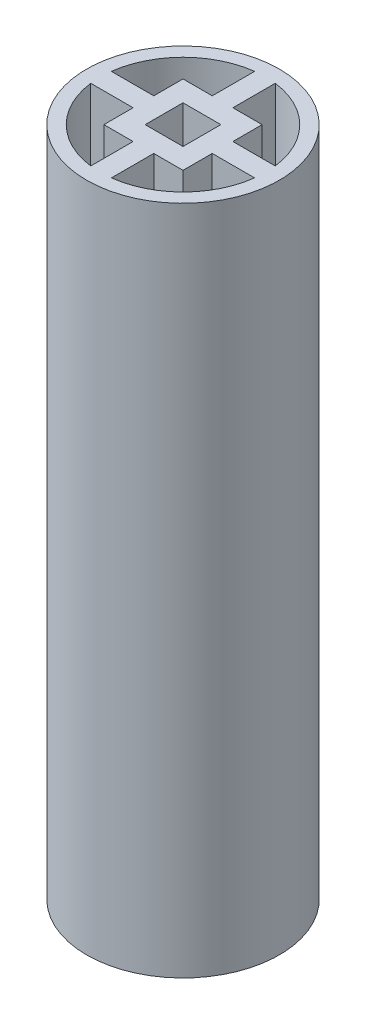
from build123d import *

# Parameters (mm, degrees)
SKETCH1_R  = 14
SKETCH1_W  = 5.5
SKETCH1_H  = 5.5
BODY_DEPTH = 48.75


with BuildPart() as part:
    # Sketch1 → Body (new, symmetric)
    with BuildSketch(Plane(origin=(0, 0, 0), x_dir=(1, 0, 0), z_dir=(0, 1, 0))):
        with Locations(Location((0, 0, 0), (0, 0, 270))):
            Circle(SKETCH1_R)
        with BuildLine():
            Line((-5.75, 1.5), (-11.9058809, 1.5))
            ThreePointArc((-11.9058809, 1.5), (-8.485281374, 8.485281374), (-1.5, 11.9058809))
            Line((-1.5, 11.9058809), (-1.5, 5.75))
            Line((-1.5, 5.75), (-5.75, 5.75))
            Line((-5.75, 5.75), (-5.75, 1.5))
        make_face(mode=Mode.SUBTRACT)
        with BuildLine():
            Line((5.75, -5.75), (1.5, -5.75))
            Line((1.5, -5.75), (1.5, -11.9058809))
            ThreePointArc((1.5, -11.9058809), (8.485281374, -8.485281374), (11.9058809, -1.5))
            Line((11.9058809, -1.5), (5.75, -1.5))
            Line((5.75, -1.5), (5.75, -5.75))
        make_face(mode=Mode.SUBTRACT)
        with BuildLine():
            Line((5.75, 5.75), (1.5, 5.75))
            Line((1.5, 5.75), (1.5, 11.9058809))
            ThreePointArc((1.5, 11.9058809), (8.485281374, 8.485281374), (11.9058809, 1.5))
            Line((11.9058809, 1.5), (5.75, 1.5))
            Line((5.75, 1.5), (5.75, 5.75))
        make_face(mode=Mode.SUBTRACT)
        with BuildLine():
            Line((-5.75, -5.75), (-5.75, -1.5))
            Line((-5.75, -1.5), (-11.9058809, -1.5))
            ThreePointArc((-11.9058809, -1.5), (-8.485281374, -8.485281374), (-1.5, -11.9058809))
            Line((-1.5, -11.9058809), (-1.5, -5.75))
            Line((-1.5, -5.75), (-5.75, -5.75))
        make_face(mode=Mode.SUBTRACT)
        Rectangle(SKETCH1_W, SKETCH1_H, mode=Mode.SUBTRACT)
    extrude(amount=BODY_DEPTH, both=True)


solid = part.part
